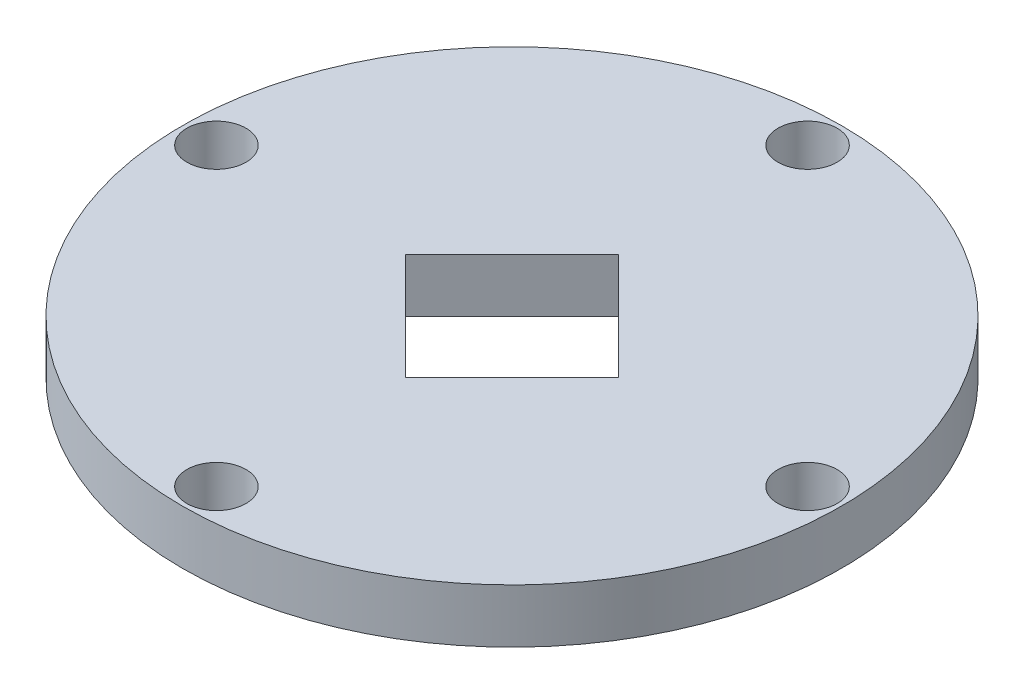
from build123d import *

# Parameters (mm, degrees)
SKETCH1_R           = 22.300536675
BOSS_EXTRUDE1_DEPTH = 3.65
SKETCH2_R           = 2
CUT_EXTRUDE1_DEPTH  = 32.748234155


with BuildPart() as part:
    # Sketch1 → Boss-Extrude1 (new body)
    with BuildSketch(Plane(origin=(0, 0, 0), x_dir=(1, 0, 0), z_dir=(0, 1, 0))):
        with Locations(Location((0, 0, 0), (0, 0, 270))):
            Circle(SKETCH1_R)
        Polygon((-7.212489168, 0), (0, -7.212489168), (7.212489168, 0), (0, 7.212489168), align=None, mode=Mode.SUBTRACT)
    extrude(amount=BOSS_EXTRUDE1_DEPTH)

    # Sketch2 → Cut-Extrude1 (cut, through all)
    with BuildSketch(Plane(origin=(0, 3.65, 0), x_dir=(1, 0, 0), z_dir=(0, 1, 0))):
        with Locations(Location((0, 20, 0), (0, 0, 270))):
            Circle(SKETCH2_R)
        with Locations(Location((20, 0, 0), (0, 0, 270))):
            Circle(SKETCH2_R)
        with Locations(Location((0, -20, 0), (0, 0, 270))):
            Circle(SKETCH2_R)
        with Locations(Location((-20, 0, 0), (0, 0, 270))):
            Circle(SKETCH2_R)
    extrude(amount=-CUT_EXTRUDE1_DEPTH, mode=Mode.SUBTRACT)


solid = part.part
